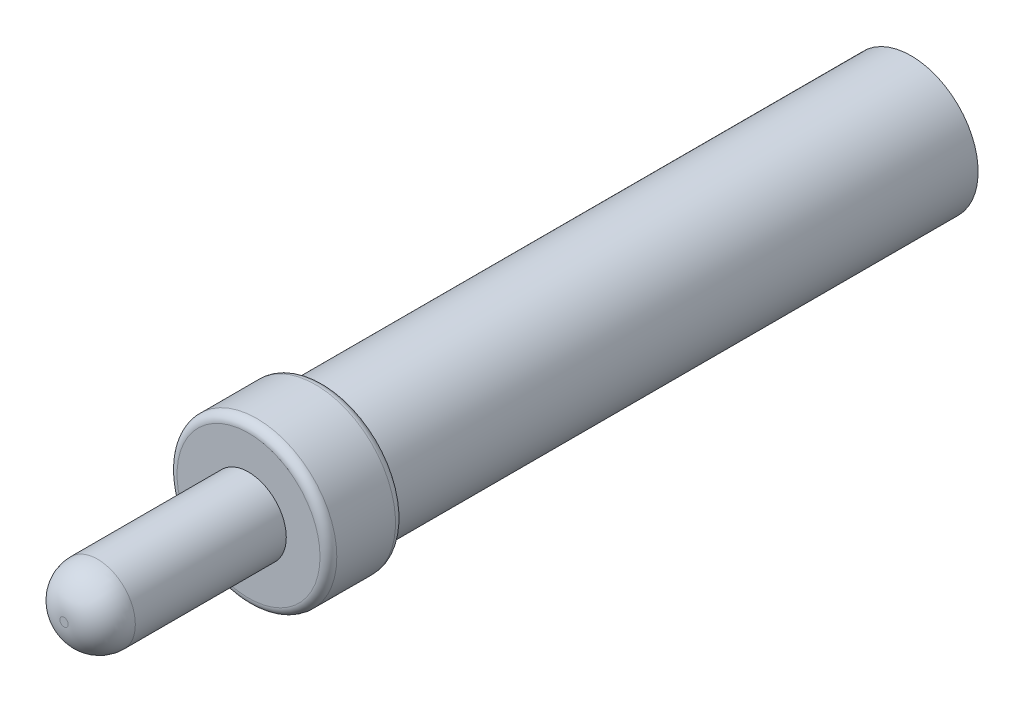
from build123d import *

# Parameters (mm, degrees)
ESBO_O1_R                     = 4.7625
RESSALTO_EXTRUS_O1_DEPTH      = 50.5
FURO_ROSCADO_DE_M3X0_52_D     = 2.5
FURO_ROSCADO_DE_M3X0_52_DEPTH = 8.5
FURO_ROSCADO_DE_M3X0_52_TIP   = 0.751075774
ESBO_O8_OUTSIDE_W             = 21.979
ESBO_O8_OUTSIDE_H             = 21.979
ESBO_O8_OUTSIDE_R             = 4
CORTE_EXTRUS_O1_DEPTH         = 35
ESBO_O10_OUTSIDE_W            = 21.979
ESBO_O10_OUTSIDE_H            = 21.979
ESBO_O10_OUTSIDE_R            = 2.25
CORTE_EXTRUS_O2_DEPTH         = 11
FILETE1_R                     = 0.5
FILETE2_R                     = 2


with BuildPart() as part:
    # Esboço1 → Ressalto-extrusão1 (new body)
    with BuildSketch(Plane.XY):
        with Locations((240.708388302, 2.596082859)):
            Circle(ESBO_O1_R)
    extrude(amount=RESSALTO_EXTRUS_O1_DEPTH)

    # Furo roscado de M3x0.52
    with Locations(Plane(origin=(0, 0, 0), x_dir=(-1, 0, 0), z_dir=(0, 0, -1))):
        with Locations((-240.708388302, 2.596082859)):
            Hole(FURO_ROSCADO_DE_M3X0_52_D / 2, depth=FURO_ROSCADO_DE_M3X0_52_DEPTH)
            with Locations((0, 0, -(FURO_ROSCADO_DE_M3X0_52_DEPTH + FURO_ROSCADO_DE_M3X0_52_TIP / 2))):  # 118° drill point
                Cone(0, FURO_ROSCADO_DE_M3X0_52_D / 2, FURO_ROSCADO_DE_M3X0_52_TIP, mode=Mode.SUBTRACT)

    # Esboço8 outside → Corte-extrusão1 (cut)
    with BuildSketch(Plane(origin=(0, 0, 0), x_dir=(-1, 0, 0), z_dir=(0, 0, -1))):
        with Locations((-240.7085, 2.5965)):
            Rectangle(ESBO_O8_OUTSIDE_W, ESBO_O8_OUTSIDE_H)
        with Locations((-240.708388302, 2.596082859)):
            Circle(ESBO_O8_OUTSIDE_R, mode=Mode.SUBTRACT)
    extrude(amount=-CORTE_EXTRUS_O1_DEPTH, mode=Mode.SUBTRACT)

    # Esboço10 outside → Corte-extrusão2 (cut)
    with BuildSketch(Plane.XY.offset(50.5)):
        with Locations((240.7085, 2.5965)):
            Rectangle(ESBO_O10_OUTSIDE_W, ESBO_O10_OUTSIDE_H)
        with Locations((240.708388302, 2.596082859)):
            Circle(ESBO_O10_OUTSIDE_R, mode=Mode.SUBTRACT)
    extrude(amount=-CORTE_EXTRUS_O2_DEPTH, mode=Mode.SUBTRACT)

    # Filete1
    filete1_edges = [part.edges().sort_by_distance(p)[0] for p in [
        (235.945888302, 2.596082859, 35),
        (235.945888302, 2.596082859, 39.5),
    ]]
    fillet(filete1_edges, radius=FILETE1_R)

    # Filete2
    filete2_edges = [part.edges().sort_by_distance(p)[0] for p in [
        (238.458388302, 2.596082859, 50.5),
    ]]
    fillet(filete2_edges, radius=FILETE2_R)


solid = part.part
